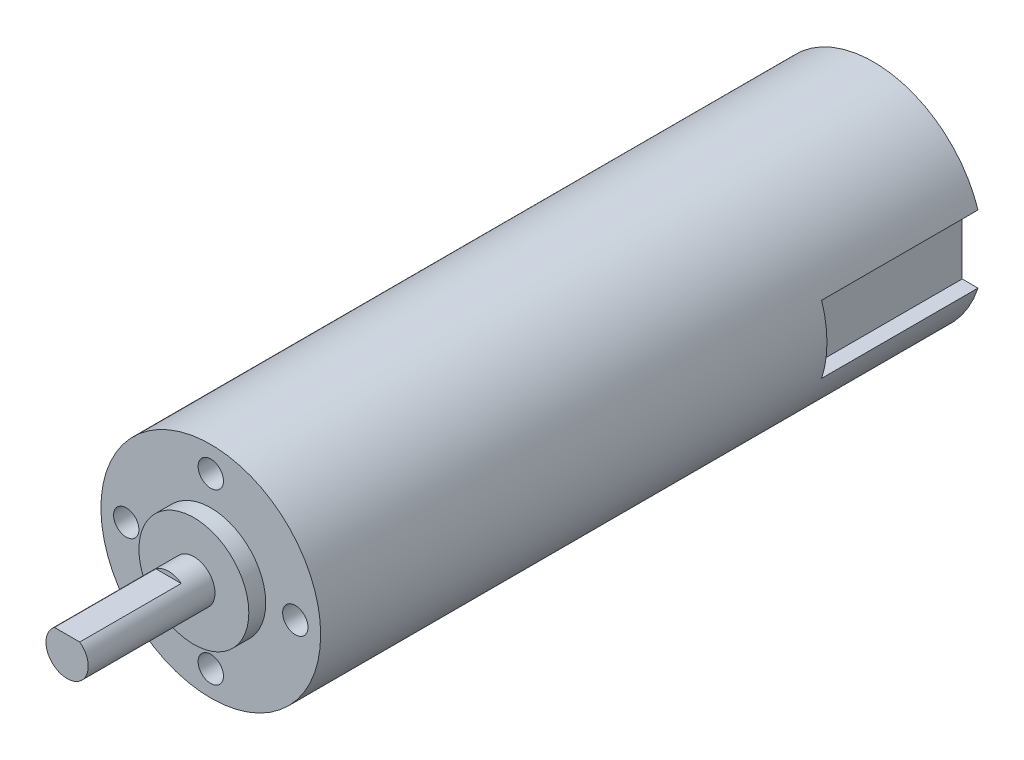
from build123d import *

# Parameters (mm, degrees)
ESQUISSE1_R             = 13
BOSS_EXTRU_1_DEPTH      = 78.4
ESQUISSE2_R             = 2.5
BOSS_EXTRU_2_DEPTH      = 17
ENL_V_MAT_EXTRU_1_DEPTH = 18.5
ESQUISSE4_R             = 6.5
ESQUISSE4_R_2           = 2.5
BOSS_EXTRU_3_DEPTH      = 2
ESQUISSE5_R             = 1.5
ENL_V_MAT_EXTRU_2_DEPTH = 4
ENL_V_START             = -12
ENL_V_MAT_EXTRU_3_DEPTH = 12


with BuildPart() as part:
    # Esquisse1 → Boss.-Extru.1 (new body)
    with BuildSketch(Plane.XY):
        Circle(ESQUISSE1_R)
    extrude(amount=BOSS_EXTRU_1_DEPTH)

    # Esquisse2 → Boss.-Extru.2 (add)
    with BuildSketch(Plane.XY.offset(78.4)):
        Circle(ESQUISSE2_R)
    extrude(amount=BOSS_EXTRU_2_DEPTH)

    # Esquisse3 → Enlèv. mat.-Extru.1 (cut)
    with BuildSketch(Plane(origin=(0, 0, 0), x_dir=(-1, 0, 0), z_dir=(0, 0, -1))):
        with BuildLine():
            Line((-10.5, 0), (-10.5, 4))
            Line((-10.5, 4), (-12.369316877, 4))
            ThreePointArc((-12.369316877, 4), (-13, 0), (-12.369316877, -4))
            Line((-12.369316877, -4), (-10.5, -4))
            Line((-10.5, -4), (-10.5, 0))
        make_face()
        with BuildLine():
            Line((10.5, 0), (10.5, 4))
            Line((10.5, 4), (12.369316877, 4))
            ThreePointArc((12.369316877, 4), (12.99999812, -0.006990598), (12.365007817, -4.013300596))
            Line((12.365007817, -4.013300596), (10.5, -4))
            Line((10.5, -4), (10.5, 0))
        make_face()
    extrude(amount=-ENL_V_MAT_EXTRU_1_DEPTH, mode=Mode.SUBTRACT)

    # Esquisse4 → Boss.-Extru.3 (add)
    with BuildSketch(Plane.XY.offset(78.4)):
        Circle(ESQUISSE4_R)
        Circle(ESQUISSE4_R_2, mode=Mode.SUBTRACT)
    extrude(amount=BOSS_EXTRU_3_DEPTH)

    # Esquisse5 → Enlèv. mat.-Extru.2 (cut)
    with BuildSketch(Plane.XY.offset(78.4)):
        with Locations((0, 10)):
            Circle(ESQUISSE5_R)
        with Locations((-10, 0)):
            Circle(ESQUISSE5_R)
        with Locations((0, -10)):
            Circle(ESQUISSE5_R)
        with Locations((10, 0)):
            Circle(ESQUISSE5_R)
    extrude(amount=-ENL_V_MAT_EXTRU_2_DEPTH, mode=Mode.SUBTRACT)

    # Esquisse6 → Enlèv. mat.-Extru.3 (cut)
    with BuildSketch(Plane.XY.offset(95.4).offset(ENL_V_START)):
        with BuildLine():
            Line((0, 2), (1.5, 2))
            ThreePointArc((1.5, 2), (0, 2.5), (-1.5, 2))
            Line((-1.5, 2), (0, 2))
        make_face()
    extrude(amount=ENL_V_MAT_EXTRU_3_DEPTH, mode=Mode.SUBTRACT)


solid = part.part
